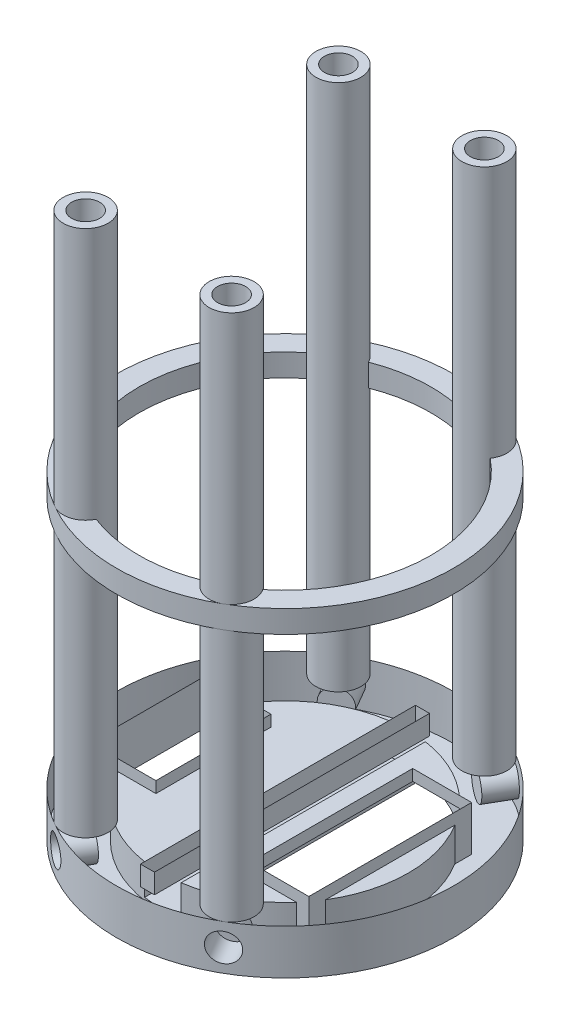
from build123d import *

# Parameters (mm, degrees)
SKETCH_1_R               = 17.6
EXTRUDE_1_DEPTH          = 1.6
SKETCH_1_3_R             = 24
SKETCH_1_3_R_2           = 17.6
EXTRUDE_2_DEPTH          = 6.4
SKETCH_1_4_W             = 5.2
SKETCH_1_4_H             = 42.4
EXTRUDE_3_DEPTH          = 6
SKETCH_1_5_W             = 2
SKETCH_1_5_H             = 39.2
CUT_EXTRUDE_1_DEPTH      = 2.8
SKETCH_1_6_W             = 8.4
SKETCH_1_6_H             = 23.2
SKETCH_1_6_W_2           = 9.4
SKETCH_1_6_H_2           = 16.4
CUT_EXTRUDE_2_DEPTH      = 10
SKETCH_1_7_R             = 3.2
EXTRUDE_4_DEPTH          = 75.2
EXTRUDE_5_DEPTH          = 1.6
EXTRUDE_5_DEPTH_BACK     = 1.6
SKETCH_2_R               = 24
SKETCH_2_R_2             = 20.8
SKETCH_3_R               = 2
CUT_EXTRUDE_3_DEPTH      = 4
SKETCH_4_R               = 2
CUT_EXTRUDE_4_DEPTH      = 4
MIRROR_2_COPY_1_SKETCH_R = 2
MIRROR_2_COPY_1_DEPTH    = 4
MIRROR_2_COPY_2_SKETCH_R = 2
MIRROR_2_COPY_2_DEPTH    = 4


with BuildPart() as part:
    # 草圖1 → 填料-伸長1 (new body)
    with BuildSketch(Plane(origin=(0, 0, 0), x_dir=(1, 0, 0), z_dir=(0, 1, 0))):
        Circle(SKETCH_1_R)
    extrude(amount=-EXTRUDE_1_DEPTH)

    # 草圖1<3> → 填料-伸長2 (add)
    with BuildSketch(Plane(origin=(0, 0, 0), x_dir=(1, 0, 0), z_dir=(0, 1, 0))):
        Circle(SKETCH_1_3_R)
        Circle(SKETCH_1_3_R_2, mode=Mode.SUBTRACT)
    extrude(amount=-EXTRUDE_2_DEPTH)

    # 草圖1<4> → 填料-伸長3 (add)
    with BuildSketch(Plane(origin=(0, 0, 0), x_dir=(1, 0, 0), z_dir=(0, 1, 0))):
        Rectangle(SKETCH_1_4_W, SKETCH_1_4_H)
    extrude(amount=-EXTRUDE_3_DEPTH)

    # 草圖1<5> → 除料-伸長1 (cut)
    with BuildSketch(Plane(origin=(0, 0, 0), x_dir=(1, 0, 0), z_dir=(0, 1, 0))):
        Rectangle(SKETCH_1_5_W, SKETCH_1_5_H)
    extrude(amount=-CUT_EXTRUDE_1_DEPTH, mode=Mode.SUBTRACT)

    # 草圖1<6> → 除料-伸長2 (cut)
    with BuildSketch(Plane(origin=(0, 0, 0), x_dir=(1, 0, 0), z_dir=(0, 1, 0))):
        with Locations((10.8, 0)):
            Rectangle(SKETCH_1_6_W, SKETCH_1_6_H)
        with Locations((-14.9, 0)):
            Rectangle(SKETCH_1_6_W_2, SKETCH_1_6_H_2)
    extrude(amount=-CUT_EXTRUDE_2_DEPTH, mode=Mode.SUBTRACT)

    # 草圖1<7> → 填料-伸長4 (add)
    with BuildSketch(Plane(origin=(0, 0, 0), x_dir=(1, 0, 0), z_dir=(0, 1, 0))):
        with Locations((-10.4, 18.013328399)):
            Circle(SKETCH_1_7_R)
        with Locations((10.4, 18.013328399)):
            Circle(SKETCH_1_7_R)
        with Locations((10.4, -18.013328399)):
            Circle(SKETCH_1_7_R)
        with Locations((-10.4, -18.013328399)):
            Circle(SKETCH_1_7_R)
    extrude(amount=EXTRUDE_4_DEPTH)

    # 草圖2 → 填料-伸長5 (add, two sides: drawn at the far end of the back side and taken through both)
    with BuildSketch(Plane(origin=(0, 37.6, 0), x_dir=(1, 0, 0), z_dir=(0, 1, 0)).offset(-EXTRUDE_5_DEPTH_BACK)):
        Circle(SKETCH_2_R)
        Circle(SKETCH_2_R_2, mode=Mode.SUBTRACT)
    extrude(amount=EXTRUDE_5_DEPTH + EXTRUDE_5_DEPTH_BACK)

    # 草圖3 → 除料-伸長3 (cut)
    with BuildSketch(Plane(origin=(0, 75.2, 0), x_dir=(1, 0, 0), z_dir=(0, 1, 0))):
        with Locations((-10.4, 18.013328399)):
            Circle(SKETCH_3_R)
        with Locations((10.4, 18.013328399)):
            Circle(SKETCH_3_R)
        with Locations((10.4, -18.013328399)):
            Circle(SKETCH_3_R)
        with Locations((-10.4, -18.013328399)):
            Circle(SKETCH_3_R)
    extrude(amount=-CUT_EXTRUDE_3_DEPTH, mode=Mode.SUBTRACT)

    # 草圖4 → 除料-伸長4 (cut)
    with BuildSketch(Plane(origin=(-12, 0, -20.784609691), x_dir=(-0.8660254037844363, 0, 0.5000000000000042), z_dir=(-0.5000000000000042, 0, -0.8660254037844363))):
        with Locations((0, -3.2)):
            Circle(SKETCH_4_R)
    cut_extrude_4 = extrude(amount=-CUT_EXTRUDE_4_DEPTH, mode=Mode.SUBTRACT)

    # 鏡射1: 除料-伸長4 across plane
    add(cut_extrude_4.mirror(Plane(origin=(0, 0, 0), x_dir=(0, 0, 1), z_dir=(1, 0, 0))), mode=Mode.SUBTRACT)

    # 鏡射2 copy 1 sketch → 鏡射2 copy 1 (cut)
    with BuildSketch(Plane(origin=(12, 0, 20.784609691), x_dir=(0.8660254037844363, 0, -0.5000000000000042), z_dir=(0.5000000000000042, 0, 0.8660254037844363))):
        with Locations((0, -3.2)):
            Circle(MIRROR_2_COPY_1_SKETCH_R)
    extrude(amount=-MIRROR_2_COPY_1_DEPTH, mode=Mode.SUBTRACT)

    # 鏡射2 copy 2 sketch → 鏡射2 copy 2 (cut)
    with BuildSketch(Plane(origin=(-12, 0, 20.784609691), x_dir=(-0.8660254037844363, 0, -0.5000000000000042), z_dir=(-0.5000000000000042, 0, 0.8660254037844363))):
        with Locations((0, 3.2)):
            Circle(MIRROR_2_COPY_2_SKETCH_R)
    extrude(amount=-MIRROR_2_COPY_2_DEPTH, mode=Mode.SUBTRACT)


solid = part.part
